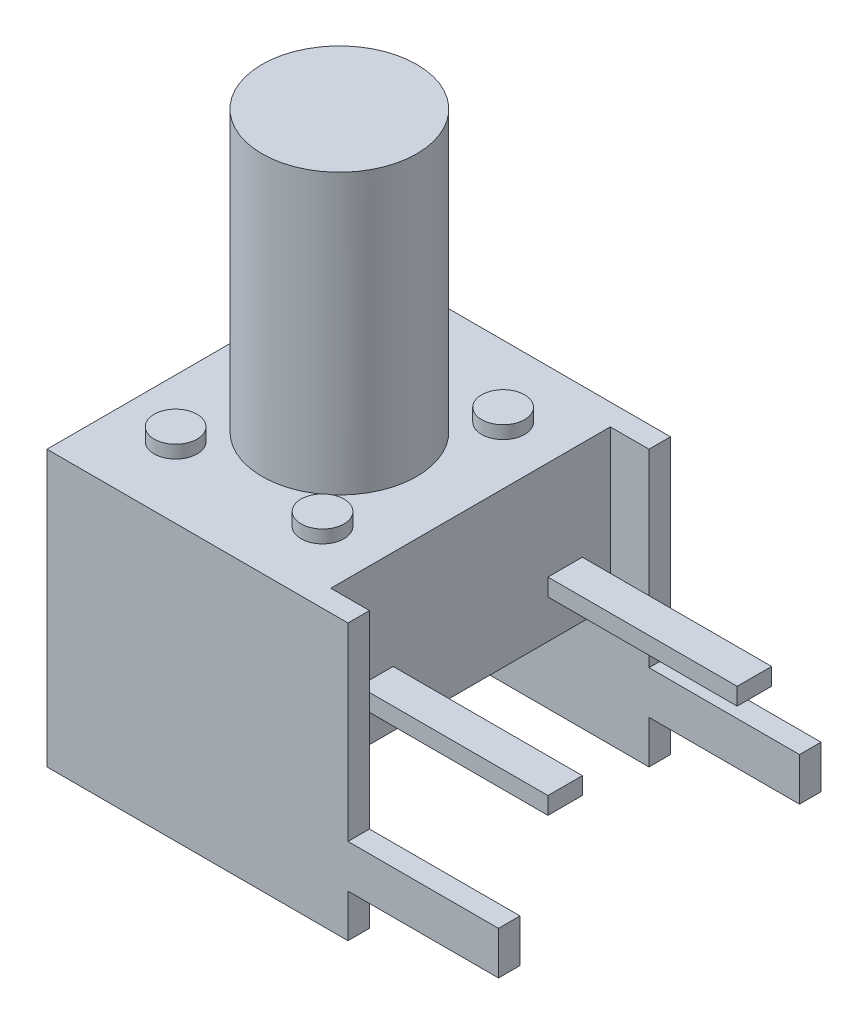
from build123d import *

# Parameters (mm, degrees)
SKETCH_1_W      = 6.1
SKETCH_1_H      = 7.5
EXTRUDE_1_DEPTH = 3.6
SKETCH_1_3_R    = 1.8
EXTRUDE_2_DEPTH = 10.1
EXTRUDE_START   = 3.6
SKETCH_1_4_R    = 0.5
EXTRUDE_3_DEPTH = 0.3
SKETCH_2_W      = 0.8
SKETCH_2_H      = 0.4
EXTRUDE_4_DEPTH = 4.4
EXTRUDE_START_2 = -6.1
SKETCH_4_W      = 0.5
SKETCH_4_H      = 6.4
EXTRUDE_5_DEPTH = 7
SKETCH_4_3_W    = 0.5
SKETCH_4_3_H    = 1
EXTRUDE_6_DEPTH = 4.4


with BuildPart() as part:
    # 草图1 → 凸台-拉伸1 (new body)
    with BuildSketch(Plane(origin=(0, 0, 0), x_dir=(1, 0, 0), z_dir=(0, 1, 0))):
        Rectangle(SKETCH_1_W, SKETCH_1_H)
    extrude(amount=EXTRUDE_1_DEPTH)

    # 草图1<3> → 凸台-拉伸2 (add)
    with BuildSketch(Plane(origin=(0, 0, 0), x_dir=(1, 0, 0), z_dir=(0, 1, 0))):
        with Locations(Location((0, 0, 0), (0, 0, 90))):
            Circle(SKETCH_1_3_R)
    extrude(amount=EXTRUDE_2_DEPTH)

    # 草图1<4> → 凸台-拉伸3 (add)
    with BuildSketch(Plane(origin=(0, 0, 0), x_dir=(1, 0, 0), z_dir=(0, 1, 0)).offset(EXTRUDE_START)):
        with Locations(Location((-1.708, 2.1, 0), (0, 0, 90))):
            Circle(SKETCH_1_4_R)
        with Locations(Location((-1.708, -2.1, 0), (0, 0, 90))):
            Circle(SKETCH_1_4_R)
        with Locations(Location((1.708, -2.1, 0), (0, 0, 90))):
            Circle(SKETCH_1_4_R)
        with Locations(Location((1.708, 2.1, 0), (0, 0, 90))):
            Circle(SKETCH_1_4_R)
    extrude(amount=EXTRUDE_3_DEPTH)

    # 草图2 → 凸台-拉伸4 (add)
    with BuildSketch(Plane(origin=(3.05, 0, 0), x_dir=(0, 0, -1), z_dir=(1, 0, 0))):
        with Locations((-2.2, 1.1)):
            Rectangle(SKETCH_2_W, SKETCH_2_H)
        with Locations((2.2, 1.1)):
            Rectangle(SKETCH_2_W, SKETCH_2_H)
    extrude(amount=EXTRUDE_4_DEPTH)

    # 草图4 → 凸台-拉伸5 (add)
    with BuildSketch(Plane(origin=(3.05, 0, 0), x_dir=(0, 0, -1), z_dir=(1, 0, 0)).offset(EXTRUDE_START_2)):
        with Locations((-3.5, 0.4)):
            Rectangle(SKETCH_4_W, SKETCH_4_H)
        with Locations((3.5, 0.4)):
            Rectangle(SKETCH_4_W, SKETCH_4_H)
    extrude(amount=EXTRUDE_5_DEPTH)

    # 草图4<3> → 凸台-拉伸6 (add)
    with BuildSketch(Plane(origin=(3.05, 0, 0), x_dir=(0, 0, -1), z_dir=(1, 0, 0))):
        with Locations((3.5, -1.3)):
            Rectangle(SKETCH_4_3_W, SKETCH_4_3_H)
        with Locations((-3.5, -1.3)):
            Rectangle(SKETCH_4_3_W, SKETCH_4_3_H)
    extrude(amount=EXTRUDE_6_DEPTH)


solid = part.part
